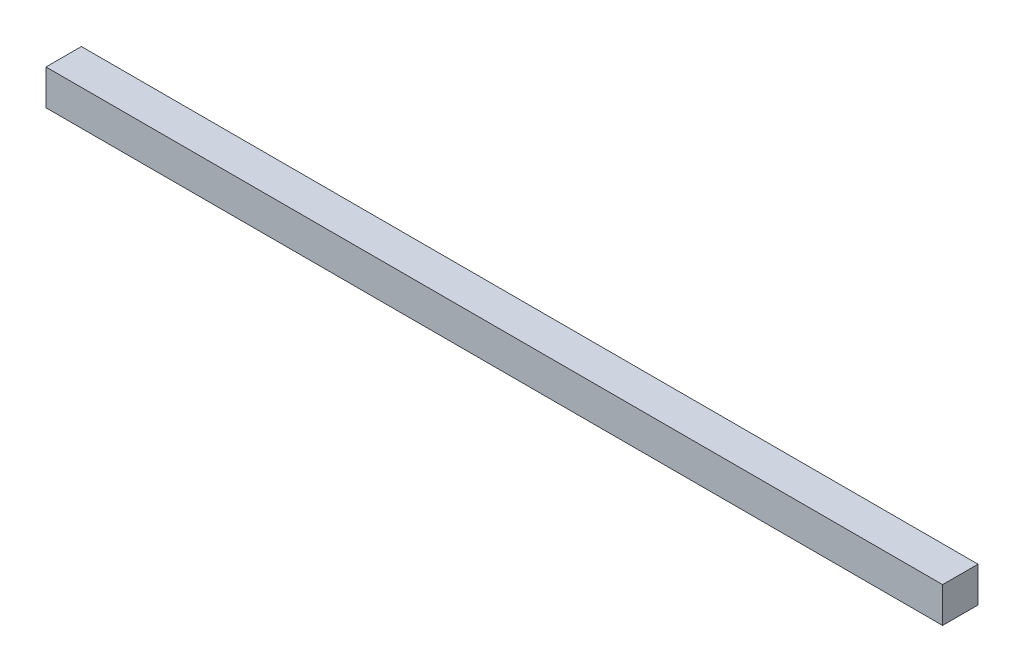
from build123d import *

# Parameters (mm, degrees)
SKETCH1_W           = 76
SKETCH1_H           = 3
BOSS_EXTRUDE1_DEPTH = 1.5


with BuildPart() as part:
    # Sketch1 → Boss-Extrude1 (new, symmetric)
    with BuildSketch(Plane(origin=(0, 0, 0), x_dir=(1, 0, 0), z_dir=(0, 1, 0))):
        Rectangle(SKETCH1_W, SKETCH1_H)
    extrude(amount=BOSS_EXTRUDE1_DEPTH, both=True)


solid = part.part
